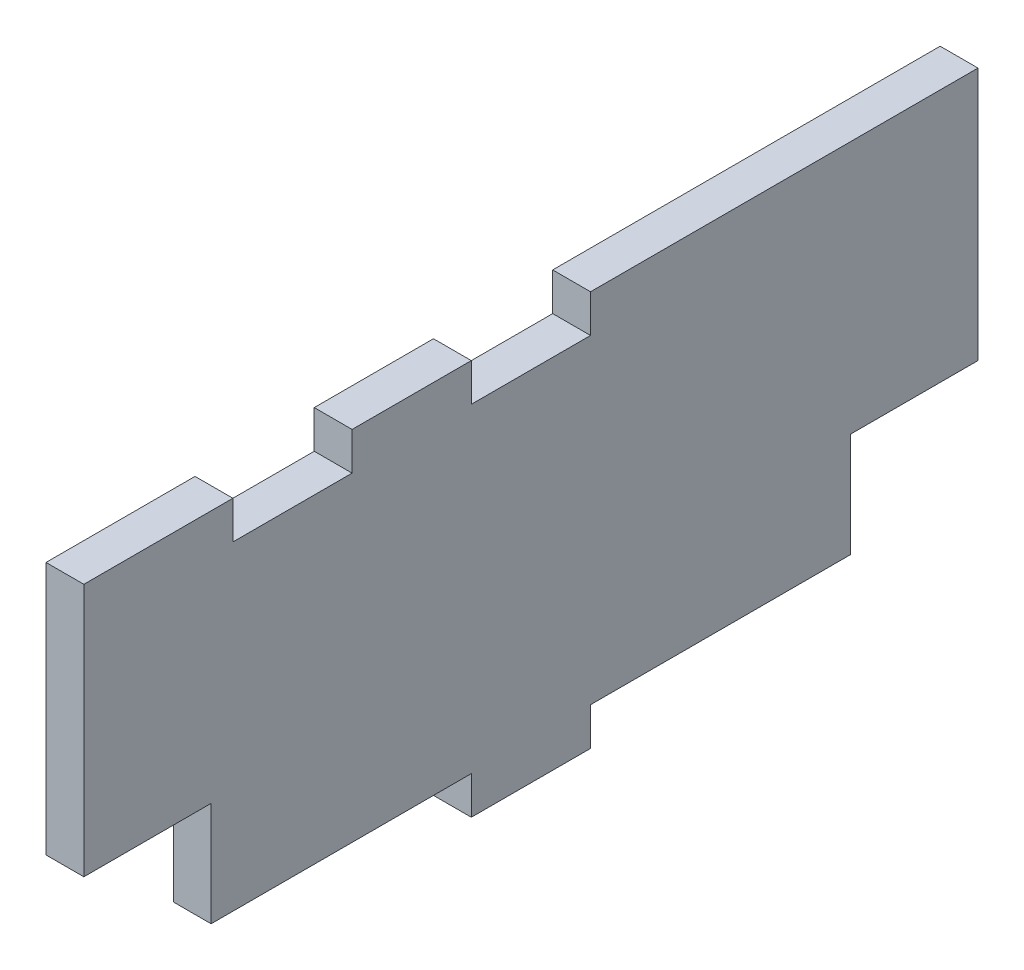
from build123d import *

# Parameters (mm, degrees)
SKETCH1_W           = 300
SKETCH1_H           = 120
SKETCH1_W_2         = 40
SKETCH1_H_2         = 12.7
BOSS_EXTRUDE1_DEPTH = 12.7
SKETCH2_W           = 42.7
SKETCH2_H           = 35
CUT_EXTRUDE1_DEPTH  = 12.7
SKETCH3_W           = 40
SKETCH3_H           = 12.7
CUT_EXTRUDE2_DEPTH  = 12.7
SKETCH4_W           = 40
SKETCH4_H           = 12.7
CUT_EXTRUDE3_DEPTH  = 12.7


with BuildPart() as part:
    # Sketch1 → Boss-Extrude1 (new body)
    with BuildSketch(Plane(origin=(0, 0, 0), x_dir=(0, 0, -1), z_dir=(1, 0, 0))):
        Rectangle(SKETCH1_W, SKETCH1_H)
        with Locations((0, -66.35)):
            Rectangle(SKETCH1_W_2, SKETCH1_H_2)
    extrude(amount=BOSS_EXTRUDE1_DEPTH)

    # Sketch2 → Cut-Extrude1 (cut)
    with BuildSketch(Plane(origin=(12.7, 0, 0), x_dir=(0, 0, -1), z_dir=(1, 0, 0))):
        with Locations((-128.65, -42.5)):
            Rectangle(SKETCH2_W, SKETCH2_H)
        with Locations((128.65, -42.5)):
            Rectangle(SKETCH2_W, SKETCH2_H)
    extrude(amount=-CUT_EXTRUDE1_DEPTH, mode=Mode.SUBTRACT)

    # Sketch3 → Cut-Extrude2 (cut)
    with BuildSketch(Plane(origin=(12.7, 0, 0), x_dir=(0, 0, -1), z_dir=(1, 0, 0))):
        with Locations((0, 53.65)):
            Rectangle(SKETCH3_W, SKETCH3_H)
    extrude(amount=-CUT_EXTRUDE2_DEPTH, mode=Mode.SUBTRACT)

    # Sketch4 → Cut-Extrude3 (cut)
    with BuildSketch(Plane(origin=(12.7, 0, 0), x_dir=(0, 0, -1), z_dir=(1, 0, 0))):
        with Locations((-80, 53.65)):
            Rectangle(SKETCH4_W, SKETCH4_H)
    extrude(amount=-CUT_EXTRUDE3_DEPTH, mode=Mode.SUBTRACT)


solid = part.part
